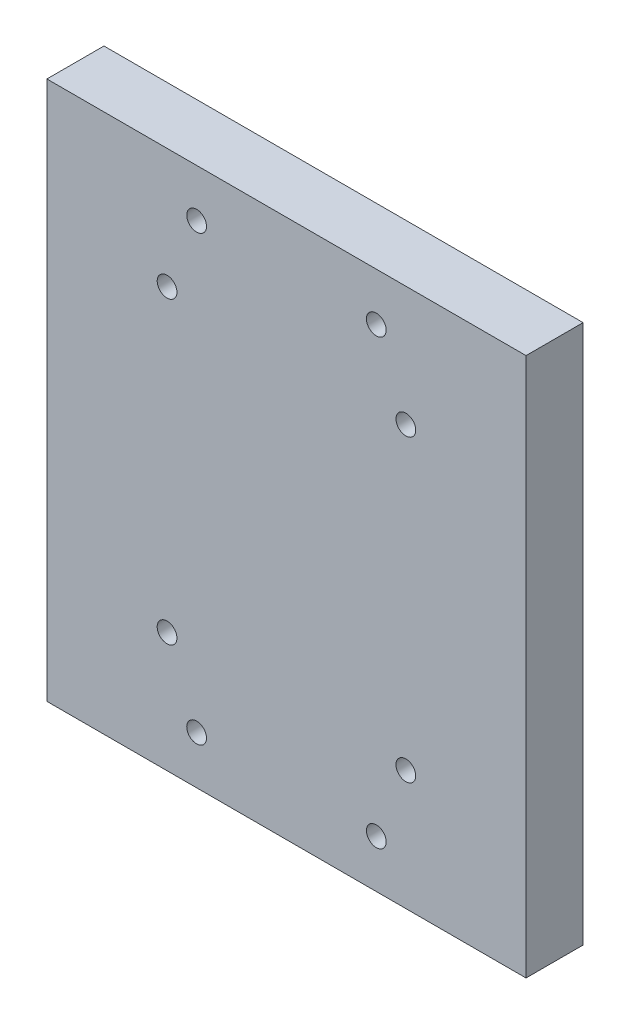
from build123d import *

# Parameters (mm, degrees)
SKETCH1_W             = 80
SKETCH1_H             = 90
SKETCH1_R             = 1.65
BOSS_EXTRUDE1_DEPTH   = 9.53
M4X0_7_TAPPED_HOLE1_D = 3.3
M4X0_7_TAPPED_HOLE2_D = 3.3


with BuildPart() as part:
    # Sketch1 → Boss-Extrude1 (new body)
    # profile 1 of 5: a face of its own
    with BuildSketch(Plane.XY):
        with Locations((40, 45)):
            Rectangle(SKETCH1_W, SKETCH1_H)
        with Locations((25, 82)):
            Circle(SKETCH1_R, mode=Mode.SUBTRACT)
        with Locations((55, 82)):
            Circle(SKETCH1_R, mode=Mode.SUBTRACT)
        with Locations((25, 8)):
            Circle(SKETCH1_R, mode=Mode.SUBTRACT)
        with Locations((55, 8)):
            Circle(SKETCH1_R, mode=Mode.SUBTRACT)
    # profile 2 of 5: a face of its own
    with BuildSketch(Plane.XY):
        with Locations((25, 8)):
            Circle(SKETCH1_R)
    # profile 3 of 5: a face of its own
    with BuildSketch(Plane.XY):
        with Locations((55, 8)):
            Circle(SKETCH1_R)
    # profile 4 of 5: a face of its own
    with BuildSketch(Plane.XY):
        with Locations((55, 82)):
            Circle(SKETCH1_R)
    # profile 5 of 5: a face of its own
    with BuildSketch(Plane.XY):
        with Locations((25, 82)):
            Circle(SKETCH1_R)
    extrude(amount=BOSS_EXTRUDE1_DEPTH)

    # M4x0.7 Tapped Hole1 (through all)
    with Locations(Plane(origin=(20.065, 70, 9.53), x_dir=(1, 0, 0), z_dir=(0, 0, 1))):
        with Locations((0, 0), (39.87, 0), (39.87, -50), (0, -50)):
            Hole(M4X0_7_TAPPED_HOLE1_D / 2)

    # M4x0.7 Tapped Hole2 (through all)
    with Locations(Plane(origin=(55, 8, 0), x_dir=(-1, 0, 0), z_dir=(0, 0, -1))):
        with Locations((0, 0), (30, 0), (30, 74), (0, 74)):
            Hole(M4X0_7_TAPPED_HOLE2_D / 2)


solid = part.part
